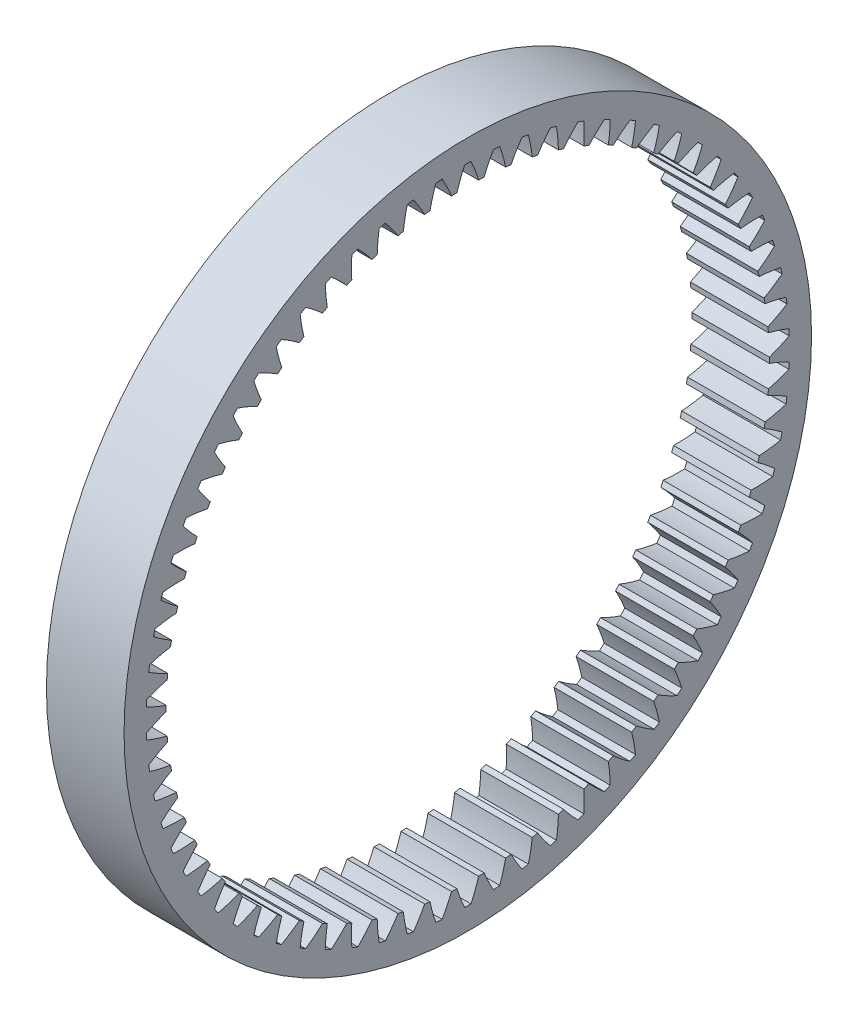
from build123d import *

# Parameters (mm, degrees)
BASPROSKE_W     = 7
BASPROSKE_H     = 3.8
TOOTHCUT_DEPTH  = 45.395945761
TEETHCUTS_COUNT = 70
TEETHCUTS_ANGLE = 354.857142857


with BuildPart() as part:
    # BasProSke → Base-Revolve (revolve)
    with BuildSketch(Plane(origin=(0, 0, 0), x_dir=(1, 0, 0), z_dir=(0, 1, 0)), mode=Mode.PRIVATE) as base_revolve_sk:
        with Locations((3.5, 29.1)):
            Rectangle(BASPROSKE_W, BASPROSKE_H)
    revolve(base_revolve_sk.sketch.rotate(Axis((-10, 0, 0), (1, 0, 0)), 180), axis=Axis((-10, 0, 0), (1, 0, 0)))

    # TooCutSke → ToothCut (cut, through all)
    with BuildSketch(Plane(origin=(0, 0, 0), x_dir=(0, 0, -1), z_dir=(1, 0, 0))):
        with BuildLine():
            ThreePointArc((0.981588854, 27.156865955), (0.666202903, 28.090477587), (0.285923142, 28.999590496))
            ThreePointArc((0.285923142, 28.999590496), (0, 29.001), (-0.285923142, 28.999590496))
            ThreePointArc((-0.285923142, 28.999590496), (-0.666202903, 28.090477587), (-0.981588854, 27.156865955))
            ThreePointArc((-0.981588854, 27.156865955), (0, 27.1746), (0.981588854, 27.156865955))
        make_face()
    toothcut = extrude(amount=TOOTHCUT_DEPTH, mode=Mode.SUBTRACT)

    # TeethCuts: ToothCut ×70 about axis
    teethcuts_axis = Axis((-10, 0, 0), (1, 0, 0))
    for i in range(1, TEETHCUTS_COUNT):
        add(toothcut.rotate(teethcuts_axis, i * TEETHCUTS_ANGLE / (TEETHCUTS_COUNT - 1)), mode=Mode.SUBTRACT)


solid = part.part
